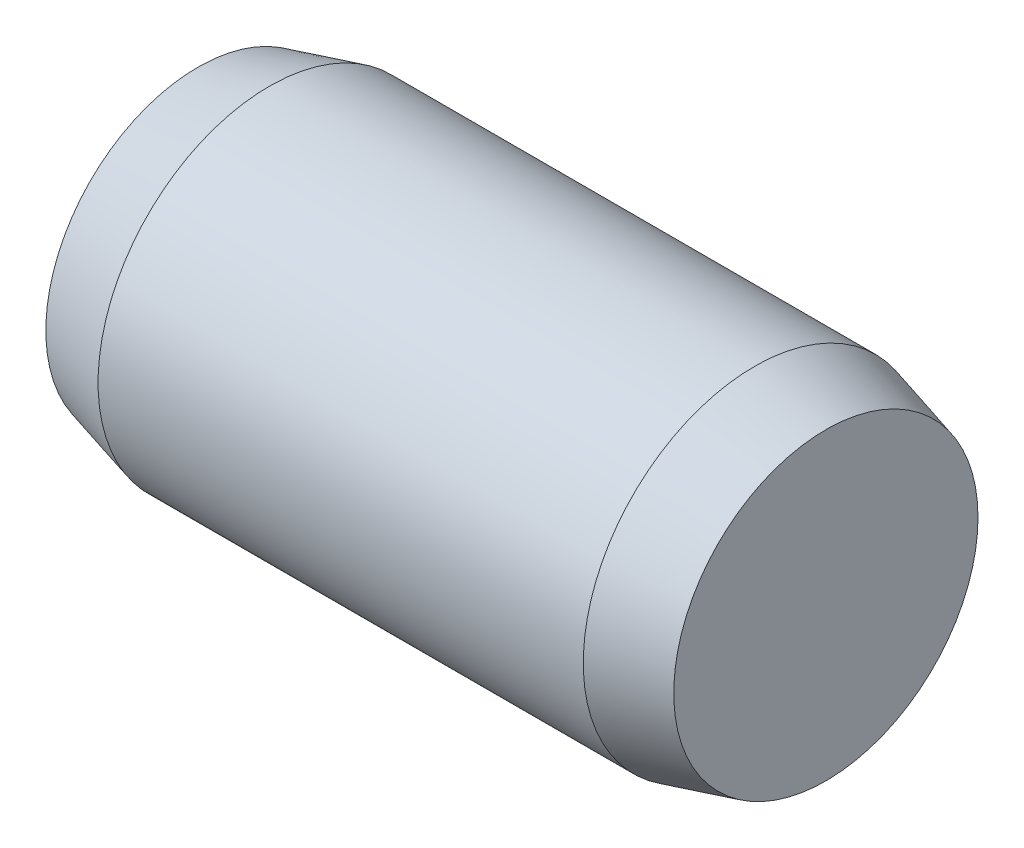
from build123d import *


with BuildPart() as part:
    # 草图1 → Revolve 489 (revolve)
    with BuildSketch(Plane.XY, mode=Mode.PRIVATE) as revolve_489_sk:
        Polygon((0, 0), (22, 0), (22, 5.330127019), (19.5, 6), (2.5, 6), (0, 5.330127019), align=None)
    revolve(revolve_489_sk.sketch.rotate(Axis((0, 0, 0), (-1, 0, 0)), 90), axis=Axis((0, 0, 0), (-1, 0, 0)))


solid = part.part
